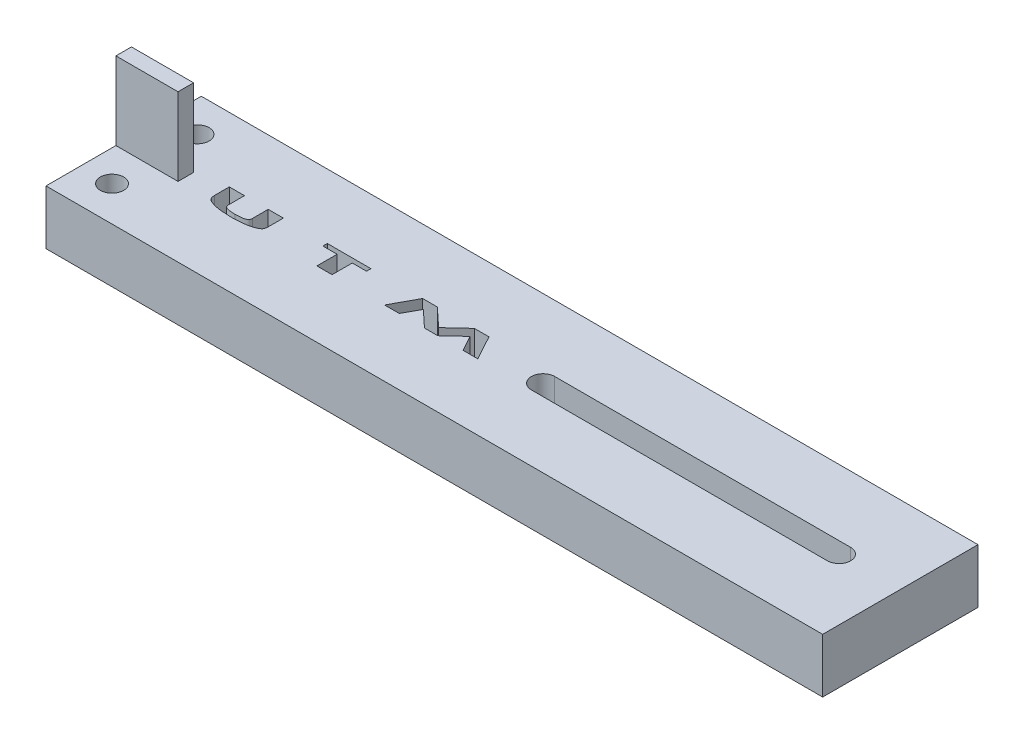
from build123d import *

# Parameters (mm, degrees)
SKETCH1_W           = 100
SKETCH1_H           = 20
BOSS_EXTRUDE1_DEPTH = 7
SKETCH2_W           = 8
SKETCH2_H           = 2
BOSS_EXTRUDE2_DEPTH = 10
SKETCH3_W           = 1.2
SKETCH3_H           = 8.2
CUT_EXTRUDE1_DEPTH  = 6.5
SKETCH4_R           = 1.5
CUT_EXTRUDE2_DEPTH  = 16.5
CUT_EXTRUDE3_DEPTH  = 16.5
CUT_EXTRUDE4_DEPTH  = 16.5


with BuildPart() as part:
    # Sketch1 → Boss-Extrude1 (new body)
    with BuildSketch(Plane(origin=(0, 0, 0), x_dir=(1, 0, 0), z_dir=(0, 1, 0))):
        Rectangle(SKETCH1_W, SKETCH1_H)
    extrude(amount=BOSS_EXTRUDE1_DEPTH)

    # Sketch2 → Boss-Extrude2 (add)
    with BuildSketch(Plane(origin=(0, 7, 0), x_dir=(1, 0, 0), z_dir=(0, 1, 0))):
        with Locations((-46, 0)):
            Rectangle(SKETCH2_W, SKETCH2_H)
    extrude(amount=BOSS_EXTRUDE2_DEPTH)

    # Sketch3 → Cut-Extrude1 (cut)
    with BuildSketch(Plane.ZY.offset(50)):
        with Locations((0, 11.1)):
            Rectangle(SKETCH3_W, SKETCH3_H)
    extrude(amount=-CUT_EXTRUDE1_DEPTH, mode=Mode.SUBTRACT)

    # Sketch4 → Cut-Extrude2 (cut)
    with BuildSketch(Plane(origin=(0, 7, 0), x_dir=(1, 0, 0), z_dir=(0, 1, 0))):
        with Locations(Location((-46, -5.5, 0), (0, 0, 270))):
            Circle(SKETCH4_R)
        with Locations(Location((-46, 5.5, 0), (0, 0, 270))):
            Circle(SKETCH4_R)
    extrude(amount=-CUT_EXTRUDE2_DEPTH, mode=Mode.SUBTRACT)

    # Sketch5 → Cut-Extrude3 (cut)
    with BuildSketch(Plane(origin=(0, 7, 0), x_dir=(1, 0, 0), z_dir=(0, 1, 0))):
        with BuildLine():
            Line((4, 1.5), (42.104534382, 1.5))
            ThreePointArc((42.104534382, 1.5), (43.604534382, 0), (42.104534382, -1.5))
            Line((42.104534382, -1.5), (4, -1.5))
            ThreePointArc((4, -1.5), (2.5, 0), (4, 1.5))
        make_face()
    extrude(amount=-CUT_EXTRUDE3_DEPTH, mode=Mode.SUBTRACT)

    # Sketch6 → Cut-Extrude4 (cut)
    with BuildSketch(Plane(origin=(0, 7, 0), x_dir=(1, 0, 0), z_dir=(0, 1, 0))):
        with BuildLine():
            Line((-38.090566617, 1.691624874), (-36.136720463, 1.691624874))
            Line((-36.136720463, 1.691624874), (-36.136720463, -0.374160382))
            add(Edge.make_bspline(
                [(-36.136720463, -0.374160382), (-36.136222921, -0.395596016), (-36.135259527, -0.437102045), (-36.128176252, -0.496659376), (-36.117267464, -0.551720243), (-36.099494327, -0.601255913), (-36.079050673, -0.647053262), (-36.052579871, -0.687323798), (-36.021884122, -0.723028206), (-35.985294073, -0.753165432), (-35.943444242, -0.779987134), (-35.896520116, -0.806221032), (-35.842987125, -0.830109847), (-35.783305155, -0.852165702), (-35.717831736, -0.873864468), (-35.646135273, -0.894146598), (-35.56817414, -0.912378535), (-35.484446285, -0.929627894), (-35.395305953, -0.944570047), (-35.30137293, -0.958050388), (-35.202951382, -0.969319491), (-35.100128875, -0.979013349), (-34.99279273, -0.985787257), (-34.881047838, -0.990848531), (-34.764636845, -0.99407686), (-34.685542294, -0.99463124), (-34.645259125, -0.994913587)],
                knots=[0, 0, 0, 0, 0.856800499, 1.659031242, 2.395514242, 3.095174505, 3.758838491, 4.395989299, 5.014775861, 5.634490662, 6.283374298, 7.000480573, 7.781977864, 8.624273548, 9.543693618, 10.539207642, 11.602158877, 12.744227547, 13.956608171, 15.215308399, 16.537999948, 17.91707144, 19.344177482, 20.837586847, 22.389370407, 24, 24, 24, 24], degree=3))
            add(Edge.make_bspline(
                [(-34.645259125, -0.994913587), (-34.602644304, -0.994619773), (-34.518887139, -0.994042296), (-34.395467432, -0.990967311), (-34.276493626, -0.985329628), (-34.162218877, -0.976931814), (-34.05233768, -0.966910998), (-33.947109184, -0.954375876), (-33.846232554, -0.938820672), (-33.750290053, -0.922073681), (-33.660190511, -0.902955674), (-33.576791977, -0.882732471), (-33.500569827, -0.861280306), (-33.431693571, -0.838617434), (-33.370513532, -0.814205685), (-33.315903174, -0.789823701), (-33.268859004, -0.763186911), (-33.228027111, -0.734837962), (-33.193111029, -0.702177186), (-33.163728858, -0.66337951), (-33.138706328, -0.618201192), (-33.118757714, -0.566526559), (-33.102800885, -0.508586363), (-33.091478933, -0.444294518), (-33.085510067, -0.373424974), (-33.084409099, -0.324137339), (-33.083835848, -0.298474285)],
                knots=[0, 0, 0, 0, 1.588209429, 3.121541213, 4.600766171, 6.026677194, 7.391541964, 8.712617744, 9.975319141, 11.1950937, 12.341822282, 13.407306122, 14.392766533, 15.292249026, 16.108021068, 16.846936864, 17.51923127, 18.119926431, 18.695626892, 19.292987148, 19.926115191, 20.614241253, 21.352269412, 22.162859459, 23.043438806, 24, 24, 24, 24], degree=3))
            Line((-33.083835848, -0.298474285), (-33.083835848, 1.691624874))
            Line((-33.083835848, 1.691624874), (-31.129989694, 1.691624874))
            Line((-31.129989694, 1.691624874), (-31.129989694, -0.202435623))
            add(Edge.make_bspline(
                [(-31.129989694, -0.202435623), (-31.130396555, -0.240823825), (-31.131179852, -0.314729458), (-31.139375273, -0.420958153), (-31.153266871, -0.518056089), (-31.172113358, -0.60591195), (-31.195776106, -0.685102071), (-31.2265614, -0.75468246), (-31.261807566, -0.815796798), (-31.304224039, -0.868565412), (-31.35433564, -0.915957753), (-31.413244095, -0.961750023), (-31.482378453, -1.006475356), (-31.560729801, -1.051863818), (-31.649567417, -1.096031718), (-31.747973897, -1.140446708), (-31.856395889, -1.184349919), (-31.973869243, -1.226902741), (-32.098340547, -1.26900542), (-32.228765844, -1.30740489), (-32.363828076, -1.343760755), (-32.503536352, -1.37752487), (-32.648066029, -1.407754368), (-32.797051714, -1.436069214), (-32.950903144, -1.460434965), (-33.109645942, -1.483126236), (-33.274098084, -1.501657516), (-33.444488933, -1.519283924), (-33.621592617, -1.533001036), (-33.805232974, -1.544180789), (-33.995384773, -1.554126205), (-34.192171214, -1.560117111), (-34.395499456, -1.564098136), (-34.533317979, -1.564553974), (-34.603281962, -1.564785382)],
                knots=[0, 0, 0, 0, 0.891995564, 1.717285311, 2.473985171, 3.169784855, 3.80406141, 4.390865003, 4.934193818, 5.438959715, 5.958162933, 6.533752086, 7.170549563, 7.870280448, 8.637066367, 9.475009947, 10.378954102, 11.354689114, 12.378321379, 13.432112796, 14.513721255, 15.6286606, 16.771808402, 17.944919068, 19.152624798, 20.3914954, 21.671212985, 22.998319501, 24.372293643, 25.798941139, 27.273951603, 28.797175972, 30.374076868, 32, 32, 32, 32], degree=3))
            add(Edge.make_bspline(
                [(-34.603281962, -1.564785382), (-34.694874664, -1.564329464), (-34.875124498, -1.563432241), (-35.141015791, -1.555385336), (-35.398042018, -1.543673109), (-35.645950763, -1.52656085), (-35.884746849, -1.504366425), (-36.114450133, -1.477165199), (-36.335189293, -1.444656968), (-36.546015909, -1.408065912), (-36.74501405, -1.367761314), (-36.92986633, -1.323831929), (-37.100308606, -1.278213772), (-37.255996039, -1.230308582), (-37.396994074, -1.179518335), (-37.523325041, -1.126403766), (-37.634981713, -1.070496906), (-37.733587124, -1.012166957), (-37.819089301, -0.946207757), (-37.892334947, -0.870525317), (-37.954025458, -0.784041833), (-38.004293928, -0.687432955), (-38.043166993, -0.580459305), (-38.07089232, -0.463535136), (-38.087398684, -0.336257042), (-38.089486381, -0.248067484), (-38.090566617, -0.202435623)],
                knots=[0, 0, 0, 0, 1.595870397, 3.140592737, 4.634612613, 6.078715518, 7.46998073, 8.812936474, 10.108520143, 11.357136621, 12.540896352, 13.645651431, 14.667177183, 15.61474762, 16.482960095, 17.277467721, 18.001045958, 18.65737072, 19.270672542, 19.876756492, 20.485670631, 21.115189159, 21.768481852, 22.463746561, 23.205097451, 24, 24, 24, 24], degree=3))
            Line((-38.090566617, -0.202435623), (-38.090566617, 1.691624874))
        make_face()
        Polygon((-25.471976873, 1.691624874), (-19.854669181, 1.691624874), (-19.854669181, 1.121753079), (-21.68639995, 1.121753079), (-21.68639995, -1.483375126), (-23.640246104, -1.483375126), (-23.640246104, 1.121753079), (-25.471976873, 1.121753079), align=None)
        Polygon((-13.19938072, 1.691624874), (-11.300868099, 1.691624874), (-8.925342258, -0.522988507), (-6.539004117, 1.691624874), (-4.653211849, 1.691624874), (-2.921335848, -1.483375126), (-4.819848468, -1.483375126), (-5.913162771, 0.521988456), (-8.074350671, -1.483375126), (-9.786510127, -1.483375126), (-11.937521745, 0.521988456), (-13.03020003, -1.483375126), (-14.929348668, -1.483375126), align=None)
    extrude(amount=-CUT_EXTRUDE4_DEPTH, mode=Mode.SUBTRACT)


solid = part.part
